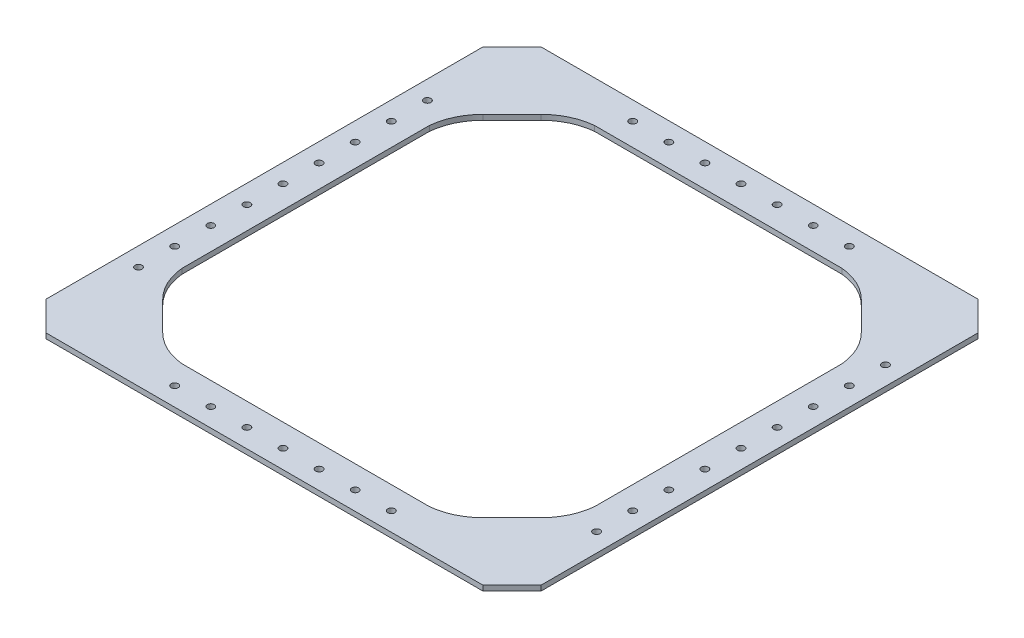
from build123d import *

# Parameters (mm, degrees)
BOSS_EXTRUDE1_DEPTH = 3.175
CUT_EXTRUDE1_DEPTH  = 252.960239461
SKETCH4_R           = 2.159
CUT_EXTRUDE2_DEPTH  = 252.960239461


with BuildPart() as part:
    # Sketch1 → Boss-Extrude1 (new body)
    with BuildSketch(Plane(origin=(0, 0, 0), x_dir=(1, 0, 0), z_dir=(0, 1, 0))):
        Polygon((-152.4, 86.220142619), (-134.439487758, 104.180654861), (134.439487758, 104.180654861), (152.4, 86.220142619), (152.4, -182.658832897), (134.439487758, -200.619345139), (-134.439487758, -200.619345139), (-152.4, -182.658832897), align=None)
    extrude(amount=BOSS_EXTRUDE1_DEPTH)

    # Sketch2 → Cut-Extrude1 (cut, through all)
    with BuildSketch(Plane(origin=(0, 3.175, 0), x_dir=(1, 0, 0), z_dir=(0, 1, 0))):
        with BuildLine():
            Line((-76.2, 78.780654861), (76.2, 78.780654861))
            ThreePointArc((76.2, 78.780654861), (88.275474207, 75.463786622), (98.518463274, 68.259630377))
            Line((98.518463274, 68.259630377), (116.478975516, 50.299118134))
            ThreePointArc((116.478975516, 50.299118134), (123.683131761, 40.056129068), (127, 27.980654861))
            Line((127, 27.980654861), (127, -124.419345139))
            ThreePointArc((127, -124.419345139), (123.683131761, -136.494819346), (116.478975516, -146.737808413))
            Line((116.478975516, -146.737808413), (98.518463274, -164.698320655))
            ThreePointArc((98.518463274, -164.698320655), (88.275474207, -171.9024769), (76.2, -175.219345139))
            Line((76.2, -175.219345139), (-76.2, -175.219345139))
            ThreePointArc((-76.2, -175.219345139), (-88.275474207, -171.9024769), (-98.518463274, -164.698320655))
            Line((-98.518463274, -164.698320655), (-116.478975516, -146.737808413))
            ThreePointArc((-116.478975516, -146.737808413), (-123.683131761, -136.494819346), (-127, -124.419345139))
            Line((-127, -124.419345139), (-127, 27.980654861))
            ThreePointArc((-127, 27.980654861), (-123.683131761, 40.056129068), (-116.478975516, 50.299118134))
            Line((-116.478975516, 50.299118134), (-98.518463274, 68.259630377))
            ThreePointArc((-98.518463274, 68.259630377), (-88.275474207, 75.463786622), (-76.2, 78.780654861))
        make_face()
    extrude(amount=-CUT_EXTRUDE1_DEPTH, mode=Mode.SUBTRACT)

    # Sketch4 → Cut-Extrude2 (cut, through all)
    with BuildSketch(Plane(origin=(0, 3.175, 0), x_dir=(1, 0, 0), z_dir=(0, 1, 0))):
        with Locations(Location((0, 92.750654861, 0), (0, 0, 270))):
            Circle(SKETCH4_R)
        with Locations(Location((-44.45, 92.750654861, 0), (0, 0, 270))):
            Circle(SKETCH4_R)
        with Locations(Location((44.45, 92.750654861, 0), (0, 0, 270))):
            Circle(SKETCH4_R)
        with Locations(Location((-22.225, 92.750654861, 0), (0, 0, 270))):
            Circle(SKETCH4_R)
        with Locations(Location((22.225, 92.750654861, 0), (0, 0, 270))):
            Circle(SKETCH4_R)
        with Locations(Location((-140.97, -48.219345139, 0), (0, 0, 270))):
            Circle(SKETCH4_R)
        with Locations(Location((-140.97, -25.994345139, 0), (0, 0, 270))):
            Circle(SKETCH4_R)
        with Locations(Location((-140.97, -3.769345139, 0), (0, 0, 270))):
            Circle(SKETCH4_R)
        with Locations(Location((140.97, -48.219345139, 0), (0, 0, 270))):
            Circle(SKETCH4_R)
        with Locations(Location((140.97, -25.994345139, 0), (0, 0, 270))):
            Circle(SKETCH4_R)
        with Locations(Location((140.97, -3.769345139, 0), (0, 0, 270))):
            Circle(SKETCH4_R)
        with Locations(Location((140.97, -92.669345139, 0), (0, 0, 90))):
            Circle(SKETCH4_R)
        with Locations(Location((140.97, -70.444345139, 0), (0, 0, 90))):
            Circle(SKETCH4_R)
        with Locations(Location((-140.97, -92.669345139, 0), (0, 0, 90))):
            Circle(SKETCH4_R)
        with Locations(Location((-140.97, -70.444345139, 0), (0, 0, 90))):
            Circle(SKETCH4_R)
        with Locations(Location((22.225, -189.189345139, 0), (0, 0, 90))):
            Circle(SKETCH4_R)
        with Locations(Location((-22.225, -189.189345139, 0), (0, 0, 90))):
            Circle(SKETCH4_R)
        with Locations(Location((44.45, -189.189345139, 0), (0, 0, 90))):
            Circle(SKETCH4_R)
        with Locations(Location((-44.45, -189.189345139, 0), (0, 0, 90))):
            Circle(SKETCH4_R)
        with Locations(Location((0, -189.189345139, 0), (0, 0, 90))):
            Circle(SKETCH4_R)
        with Locations(Location((-66.675, 92.750654861, 0), (0, 0, 270))):
            Circle(SKETCH4_R)
        with Locations(Location((66.675, 92.750654861, 0), (0, 0, 270))):
            Circle(SKETCH4_R)
        with Locations(Location((-140.97, 18.455654861, 0), (0, 0, 270))):
            Circle(SKETCH4_R)
        with Locations(Location((140.97, 18.455654861, 0), (0, 0, 270))):
            Circle(SKETCH4_R)
        with Locations(Location((140.97, -114.894345139, 0), (0, 0, 90))):
            Circle(SKETCH4_R)
        with Locations(Location((66.675, -189.189345139, 0), (0, 0, 90))):
            Circle(SKETCH4_R)
        with Locations(Location((-66.675, -189.189345139, 0), (0, 0, 90))):
            Circle(SKETCH4_R)
        with Locations(Location((-140.97, -114.894345139, 0), (0, 0, 90))):
            Circle(SKETCH4_R)
        with Locations(Location((-140.97, -137.119345139, 0), (0, 0, 270))):
            Circle(SKETCH4_R)
        with Locations(Location((-140.97, 40.680654861, 0), (0, 0, 90))):
            Circle(SKETCH4_R)
        with Locations(Location((140.97, 40.680654861, 0), (0, 0, 270))):
            Circle(SKETCH4_R)
        with Locations(Location((140.97, -137.119345139, 0), (0, 0, 90))):
            Circle(SKETCH4_R)
    extrude(amount=-CUT_EXTRUDE2_DEPTH, mode=Mode.SUBTRACT)


solid = part.part
